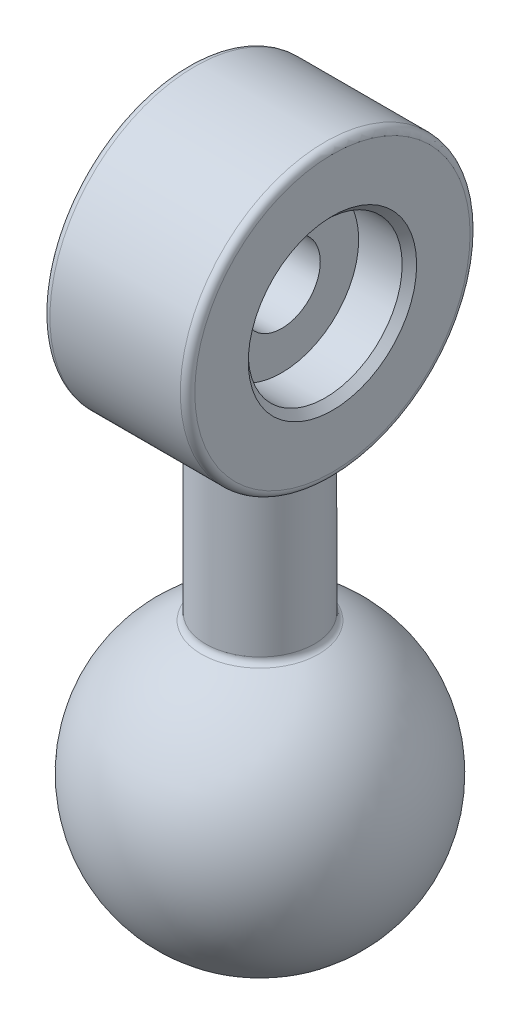
from build123d import *

# Parameters (mm, degrees)
SKETCH2_R           = 12.7
BOSS_EXTRUDE1_DEPTH = 6.35
FILLET1_R           = 0.635


with BuildPart() as part:
    # Sketch1 → Revolve1 (revolve)
    with BuildSketch(Plane.XY):
        with BuildLine():
            ThreePointArc((0, -12.7), (-12.7, 0), (0, 12.7))
            Line((0, 12.7), (0, -12.7))
        make_face()
        with BuildLine():
            ThreePointArc((-4.7625, 11.773215098), (-2.425919233, 12.466150804), (0, 12.7))
            Line((0, 12.7), (0, 38.1))
            Line((0, 38.1), (-4.7625, 38.1))
            Line((-4.7625, 38.1), (-4.7625, 11.773215098))
        make_face()
    revolve(axis=Axis((0, 12.7, 0), (0, 1, 0)))

    # Sketch2 → Boss-Extrude1 (add, symmetric)
    with BuildSketch(Plane(origin=(0, 0, 0), x_dir=(0, 0, -1), z_dir=(1, 0, 0))):
        with Locations((0, 38.1)):
            Circle(SKETCH2_R)
    extrude(amount=BOSS_EXTRUDE1_DEPTH, both=True)

    # Fillet1
    fillet1_edges = [part.edges().sort_by_distance(p)[0] for p in [
        (4.762500002, 25.4, -1e-09),
        (-6.35, 38.1, 12.7),
        (6.35, 38.1, 12.7),
        (4.7625, 11.773215098, 0),
    ]]
    fillet(fillet1_edges, radius=FILLET1_R)

    # Sketch4 → CBORE for 1/4 Pan Head Machine Screw1 (revolve, cut)
    with BuildSketch(Plane(origin=(6.35, 38.1, 0), x_dir=(0, 0, -1), z_dir=(0, 1, 0))):
        Polygon((0, 0), (0, 19.05), (3.3782, 19.05), (3.3782, 4.445), (6.74624, 4.445), (6.74624, 0.635), (7.38124, 0), align=None)
    revolve(axis=Axis((12.7, 38.1, 0), (-1, 0, 0)), mode=Mode.SUBTRACT)


solid = part.part
